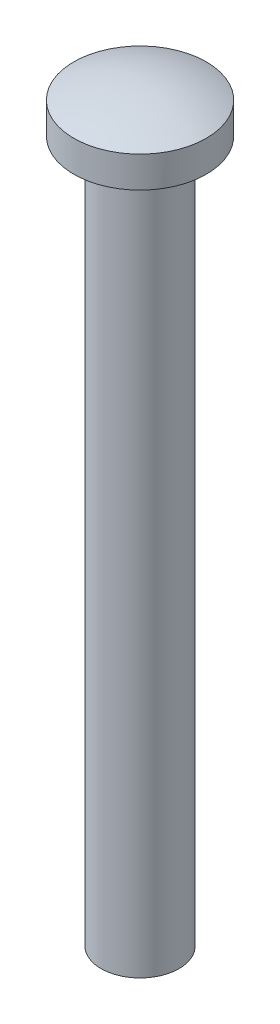
from build123d import *


with BuildPart() as part:
    # 草圖1 → 旋轉1 (revolve)
    with BuildSketch(Plane.XY, mode=Mode.PRIVATE) as revolve_1_sk:
        with BuildLine():
            Line((0, 0), (0, 9.581034604))
            ThreePointArc((0, 9.581034604), (-0.434530519, 9.535278619), (-0.85, 9.400017791))
            Line((-0.85, 9.400017791), (-0.85, 9))
            Line((-0.85, 9), (-0.5, 9))
            Line((-0.5, 9), (-0.5, 0))
            Line((-0.5, 0), (0, 0))
        make_face()
    revolve(revolve_1_sk.sketch.rotate(Axis((0, 0, 0), (0, 1, 0)), 270), axis=Axis((0, 0, 0), (0, 1, 0)))


solid = part.part
